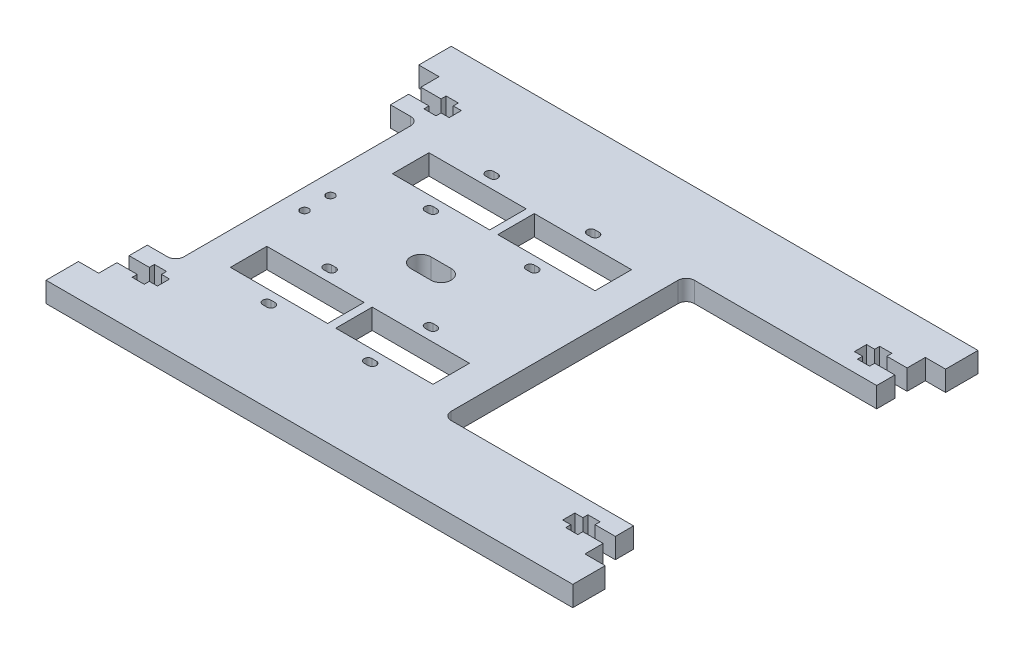
from build123d import *

# Parameters (mm, degrees)
SKETCH1_W           = 120
SKETCH1_H           = 100
SKETCH1_W_2         = 50
SKETCH1_H_2         = 9
BOSS_EXTRUDE1_DEPTH = 5
SKETCH2_W           = 5
SKETCH2_H           = 8
BOSS_EXTRUDE2_DEPTH = 5
SKETCH3_W           = 47
SKETCH3_H           = 60
SKETCH3_W_2         = 7
CUT_EXTRUDE1_DEPTH  = 161.15617378
FILLET1_R           = 2
SKETCH4_R           = 1
CUT_EXTRUDE2_DEPTH  = 161.15617378
CUT_EXTRUDE3_DEPTH  = 161.15617378
SKETCH6_W           = 2
SKETCH6_H           = 9
BOSS_EXTRUDE3_DEPTH = 5


with BuildPart() as part:
    # Sketch1 → Boss-Extrude1 (new body)
    with BuildSketch(Plane(origin=(0, 0, 0), x_dir=(1, 0, 0), z_dir=(0, 1, 0))):
        with Locations((60, 50)):
            Rectangle(SKETCH1_W, SKETCH1_H)
        with BuildLine():
            Line((27, 78.5), (28, 78.5))
            ThreePointArc((28, 78.5), (29, 77.5), (28, 76.5))
            Line((28, 76.5), (27, 76.5))
            ThreePointArc((27, 76.5), (26, 77.5), (27, 78.5))
        make_face(mode=Mode.SUBTRACT)
        with Locations((40, 70)):
            Rectangle(SKETCH1_W_2, SKETCH1_H_2, mode=Mode.SUBTRACT)
        with BuildLine():
            Line((53, 78.5), (52, 78.5))
            ThreePointArc((52, 78.5), (51, 77.5), (52, 76.5))
            Line((52, 76.5), (53, 76.5))
            ThreePointArc((53, 76.5), (54, 77.5), (53, 78.5))
        make_face(mode=Mode.SUBTRACT)
        with BuildLine():
            Line((27, 61.5), (28, 61.5))
            ThreePointArc((28, 61.5), (29, 62.5), (28, 63.5))
            Line((28, 63.5), (27, 63.5))
            ThreePointArc((27, 63.5), (26, 62.5), (27, 61.5))
        make_face(mode=Mode.SUBTRACT)
        with BuildLine():
            Line((53, 61.5), (52, 61.5))
            ThreePointArc((52, 61.5), (51, 62.5), (52, 63.5))
            Line((52, 63.5), (53, 63.5))
            ThreePointArc((53, 63.5), (54, 62.5), (53, 61.5))
        make_face(mode=Mode.SUBTRACT)
        with BuildLine():
            Line((27, 21.5), (28, 21.5))
            ThreePointArc((28, 21.5), (29, 22.5), (28, 23.5))
            Line((28, 23.5), (27, 23.5))
            ThreePointArc((27, 23.5), (26, 22.5), (27, 21.5))
        make_face(mode=Mode.SUBTRACT)
        with BuildLine():
            Line((53, 21.5), (52, 21.5))
            ThreePointArc((52, 21.5), (51, 22.5), (52, 23.5))
            Line((52, 23.5), (53, 23.5))
            ThreePointArc((53, 23.5), (54, 22.5), (53, 21.5))
        make_face(mode=Mode.SUBTRACT)
        with BuildLine():
            Line((27, 38.5), (28, 38.5))
            ThreePointArc((28, 38.5), (29, 37.5), (28, 36.5))
            Line((28, 36.5), (27, 36.5))
            ThreePointArc((27, 36.5), (26, 37.5), (27, 38.5))
        make_face(mode=Mode.SUBTRACT)
        with BuildLine():
            Line((53, 38.5), (52, 38.5))
            ThreePointArc((52, 38.5), (51, 37.5), (52, 36.5))
            Line((52, 36.5), (53, 36.5))
            ThreePointArc((53, 36.5), (54, 37.5), (53, 38.5))
        make_face(mode=Mode.SUBTRACT)
        with Locations((40, 30)):
            Rectangle(SKETCH1_W_2, SKETCH1_H_2, mode=Mode.SUBTRACT)
    extrude(amount=BOSS_EXTRUDE1_DEPTH)

    # Sketch2 → Boss-Extrude2 (add)
    with BuildSketch(Plane(origin=(0, 5, 0), x_dir=(1, 0, 0), z_dir=(0, 1, 0))):
        with Locations((122.5, 96)):
            Rectangle(SKETCH2_W, SKETCH2_H)
        with Locations((122.5, 4)):
            Rectangle(SKETCH2_W, SKETCH2_H)
        with Locations((-2.5, 4)):
            Rectangle(SKETCH2_W, SKETCH2_H)
        with Locations((-2.5, 96)):
            Rectangle(SKETCH2_W, SKETCH2_H)
    extrude(amount=-BOSS_EXTRUDE2_DEPTH)

    # Sketch3 → Cut-Extrude1 (cut, through all)
    with BuildSketch(Plane(origin=(0, 5, 0), x_dir=(1, 0, 0), z_dir=(0, 1, 0))):
        with Locations((96.5, 50)):
            Rectangle(SKETCH3_W, SKETCH3_H)
        with Locations((3.5, 50)):
            Rectangle(SKETCH3_W_2, SKETCH3_H)
    extrude(amount=-CUT_EXTRUDE1_DEPTH, mode=Mode.SUBTRACT)

    # Fillet1
    fillet1_edges = [part.edges().sort_by_distance(p)[0] for p in [
        (73, 2.5, -20),
        (73, 2.5, -80),
        (7, 2.5, -80),
        (7, 2.5, -20),
    ]]
    fillet(fillet1_edges, radius=FILLET1_R)

    # Sketch4 → Cut-Extrude2 (cut, through all)
    with BuildSketch(Plane(origin=(0, 5, 0), x_dir=(1, 0, 0), z_dir=(0, 1, 0))):
        with Locations(Location((12, 53.2, 0), (0, 0, 270))):
            Circle(SKETCH4_R)
        with Locations(Location((12, 46.8, 0), (0, 0, 270))):
            Circle(SKETCH4_R)
        with BuildLine():
            Line((37.5, 52.5), (42.5, 52.5))
            ThreePointArc((42.5, 52.5), (45, 50), (42.5, 47.5))
            Line((42.5, 47.5), (37.5, 47.5))
            ThreePointArc((37.5, 47.5), (35, 50), (37.5, 52.5))
        make_face()
    extrude(amount=-CUT_EXTRUDE2_DEPTH, mode=Mode.SUBTRACT)

    # Sketch5 → Cut-Extrude3 (cut, through all)
    with BuildSketch(Plane(origin=(0, 5, 0), x_dir=(1, 0, 0), z_dir=(0, 1, 0))):
        Polygon((120, 15.5), (115, 15.5), (115, 16.75), (112, 16.75), (112, 15.5), (110, 15.5), (110, 12.5), (112, 12.5), (112, 11.25), (115, 11.25), (115, 12.5), (120, 12.5), align=None)
        Polygon((0, 12.5), (0, 15.5), (5, 15.5), (5, 16.75), (8, 16.75), (8, 15.5), (10, 15.5), (10, 12.5), (8, 12.5), (8, 11.25), (5, 11.25), (5, 12.5), align=None)
        Polygon((0, 84.5), (5, 84.5), (5, 83.25), (8, 83.25), (8, 84.5), (10, 84.5), (10, 87.5), (8, 87.5), (8, 88.75), (5, 88.75), (5, 87.5), (0, 87.5), align=None)
        Polygon((120, 87.5), (120, 84.5), (115, 84.5), (115, 83.25), (112, 83.25), (112, 84.5), (110, 84.5), (110, 87.5), (112, 87.5), (112, 88.75), (115, 88.75), (115, 87.5), align=None)
    extrude(amount=-CUT_EXTRUDE3_DEPTH, mode=Mode.SUBTRACT)

    # Sketch6 → Boss-Extrude3 (add)
    with BuildSketch(Plane(origin=(0, 5, 0), x_dir=(1, 0, 0), z_dir=(0, 1, 0))):
        with Locations((40, 70)):
            Rectangle(SKETCH6_W, SKETCH6_H)
        with Locations((40, 30)):
            Rectangle(SKETCH6_W, SKETCH6_H)
    extrude(amount=-BOSS_EXTRUDE3_DEPTH)


solid = part.part
